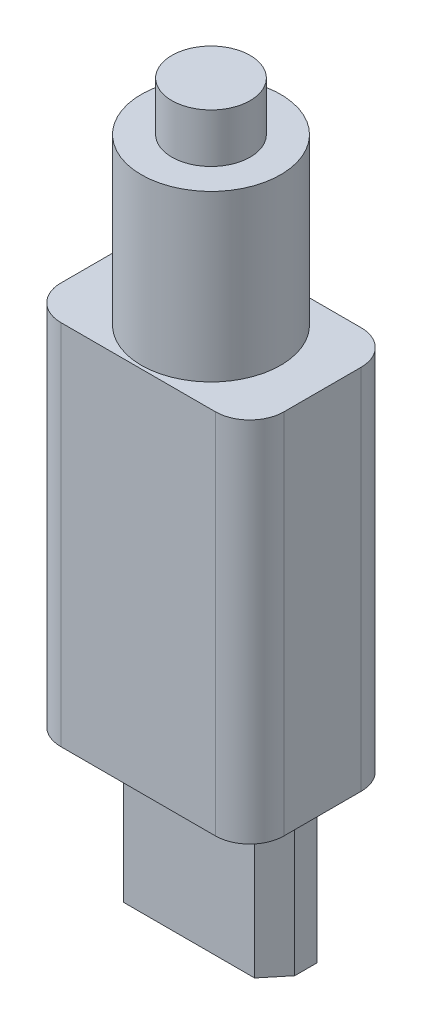
from build123d import *

# Parameters (mm, degrees)
BOSS_EXTRUDE1_DEPTH = 6.3
SKETCH2_W           = 9.11
SKETCH2_H           = 5.95
BOSS_EXTRUDE2_DEPTH = 15
FILLET1_R           = 1.4
SKETCH4_R           = 2.845
BOSS_EXTRUDE3_DEPTH = 6.74
SKETCH5_R           = 1.6
BOSS_EXTRUDE4_DEPTH = 2


with BuildPart() as part:
    # Sketch1 → Boss-Extrude1 (new body)
    with BuildSketch(Plane(origin=(0, 0, 0), x_dir=(1, 0, 0), z_dir=(0, 1, 0))):
        Polygon((-3.42, 0), (-2.68, -0.9), (2.68, -0.9), (3.42, 0), (3.42, 0.9), (-3.42, 0.9), align=None)
    extrude(amount=BOSS_EXTRUDE1_DEPTH)

    # Sketch2 → Boss-Extrude2 (add)
    with BuildSketch(Plane(origin=(0, 6.3, 0), x_dir=(1, 0, 0), z_dir=(0, 1, 0))):
        Rectangle(SKETCH2_W, SKETCH2_H)
    extrude(amount=BOSS_EXTRUDE2_DEPTH)

    # Fillet1
    fillet1_edges = [part.edges().sort_by_distance(p)[0] for p in [
        (4.555, 13.8, 2.975),
        (4.555, 13.8, -2.975),
        (-4.555, 13.8, -2.975),
        (-4.555, 13.8, 2.975),
    ]]
    fillet(fillet1_edges, radius=FILLET1_R)

    # Sketch4 → Boss-Extrude3 (add)
    with BuildSketch(Plane(origin=(0, 21.3, 0), x_dir=(1, 0, 0), z_dir=(0, 1, 0))):
        with Locations(Location((0, 0, 0), (0, 0, 270))):
            Circle(SKETCH4_R)
    extrude(amount=BOSS_EXTRUDE3_DEPTH)

    # Sketch5 → Boss-Extrude4 (add)
    with BuildSketch(Plane(origin=(0, 28.04, 0), x_dir=(1, 0, 0), z_dir=(0, 1, 0))):
        with Locations(Location((0, 0, 0), (0, 0, 270))):
            Circle(SKETCH5_R)
    extrude(amount=BOSS_EXTRUDE4_DEPTH)


solid = part.part
